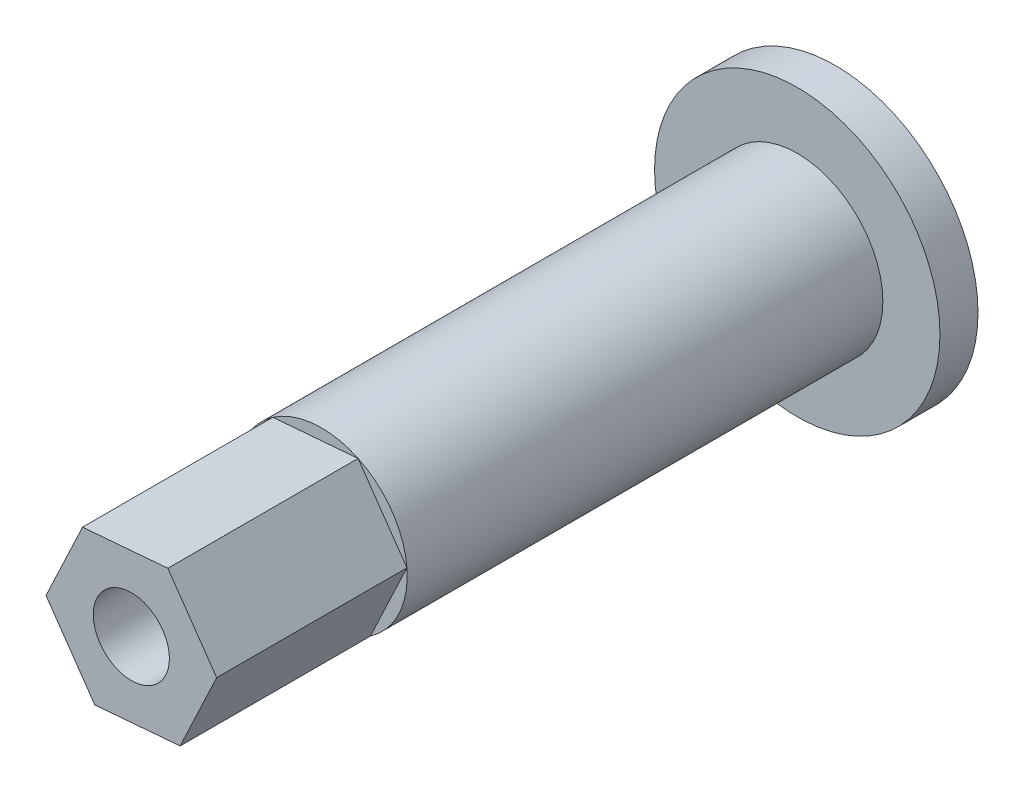
from build123d import *

# Parameters (mm, degrees)
SKETCH1_R           = 4.5
BOSS_EXTRUDE1_DEPTH = 10
BOSS_EXTRUDE2_START = 2
SKETCH2_R           = 7.5
BOSS_EXTRUDE2_DEPTH = 2
SKETCH3_R           = 4.5
BOSS_EXTRUDE3_DEPTH = 15
BOSS_EXTRUDE4_DEPTH = 10
SKETCH5_R           = 2
CUT_EXTRUDE1_DEPTH  = 6


with BuildPart() as part:
    # Sketch1 → Boss-Extrude1 (new body)
    with BuildSketch(Plane.XY):
        Circle(SKETCH1_R)
        with BuildLine():
            Line((-1.85, 1.966596044), (-1.85, -1.966596044))
            ThreePointArc((-1.85, -1.966596044), (0, -2.7), (1.85, -1.966596044))
            Line((1.85, -1.966596044), (1.85, 1.966596044))
            ThreePointArc((1.85, 1.966596044), (1.851058142, 1.9656001), (1.852115749, 1.964603587))
            ThreePointArc((1.852115749, 1.964603587), (0.001453124, 2.699999609), (-1.85, 1.966596044))
        make_face(mode=Mode.SUBTRACT)
    extrude(amount=BOSS_EXTRUDE1_DEPTH)

    # Sketch2 → Boss-Extrude2 (add)
    with BuildSketch(Plane(origin=(0, 0, 0), x_dir=(-1, 0, 0), z_dir=(0, 0, -1)).offset(BOSS_EXTRUDE2_START)):
        Circle(SKETCH2_R)
        with BuildLine():
            Line((1.85, 1.966596044), (1.85, -1.966596044))
            ThreePointArc((1.85, -1.966596044), (0, -2.7), (-1.85, -1.966596044))
            Line((-1.85, -1.966596044), (-1.85, 1.966596044))
            ThreePointArc((-1.85, 1.966596044), (0, 2.7), (1.85, 1.966596044))
        make_face(mode=Mode.SUBTRACT)
    extrude(amount=-BOSS_EXTRUDE2_DEPTH)

    # Sketch3 → Boss-Extrude3 (add)
    with BuildSketch(Plane.XY.offset(10)):
        Circle(SKETCH3_R)
    extrude(amount=BOSS_EXTRUDE3_DEPTH)

    # Sketch4 → Boss-Extrude4 (add)
    with BuildSketch(Plane.XY.offset(25)):
        Polygon((1.920788906, 4.069468022), (-2.563868233, 3.698185999), (-4.48465714, -0.371282023), (-1.920788906, -4.069468022), (2.563868233, -3.698185999), (4.48465714, 0.371282023), align=None)
    extrude(amount=BOSS_EXTRUDE4_DEPTH)

    # Sketch5 → Cut-Extrude1 (cut)
    with BuildSketch(Plane.XY.offset(35)):
        Circle(SKETCH5_R)
    extrude(amount=-CUT_EXTRUDE1_DEPTH, mode=Mode.SUBTRACT)


solid = part.part
